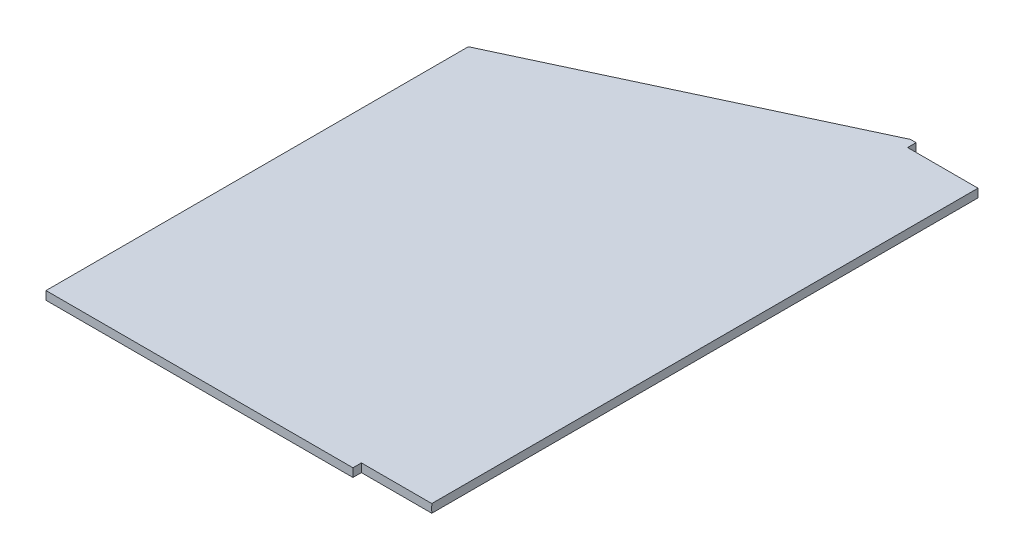
from build123d import *

# Parameters (mm, degrees)
BOSS_EXTRUDE1_DEPTH      = 1.5
BOSS_EXTRUDE1_DEPTH_BACK = 1.5
SKETCH2_R                = 51.2
CUT_EXTRUDE1_DEPTH       = 227.828679845
SKETCH3_R                = 76.2
CUT_EXTRUDE2_DEPTH       = 3
CUT_EXTRUDE3_START       = -3
SKETCH4_R                = 76.2
CUT_EXTRUDE3_DEPTH       = 3


with BuildPart() as part:
    # Sketch1 → Boss-Extrude1 (new, two sides: drawn at the far end of the back side and taken through both)
    with BuildSketch(Plane(origin=(0, 0, 0), x_dir=(1, 0, 0), z_dir=(0, 1, 0)).offset(-BOSS_EXTRUDE1_DEPTH_BACK)):
        Polygon((-107, 150), (-107, 0), (0, 0), (78.2, 0), (78.2, 200), (0, 200), align=None)
    extrude(amount=BOSS_EXTRUDE1_DEPTH + BOSS_EXTRUDE1_DEPTH_BACK)

    # Sketch2 → Cut-Extrude1 (cut, through all)
    with BuildSketch(Plane(origin=(0, 0, -200), x_dir=(-1, 0, 0), z_dir=(0, 0, -1))):
        with Locations((-78.2, 0)):
            Circle(SKETCH2_R)
    extrude(amount=-CUT_EXTRUDE1_DEPTH, mode=Mode.SUBTRACT)

    # Sketch3 → Cut-Extrude2 (cut)
    with BuildSketch(Plane(origin=(0, 0, -200), x_dir=(-1, 0, 0), z_dir=(0, 0, -1))):
        with Locations((-78.2, 0)):
            Circle(SKETCH3_R)
    extrude(amount=-CUT_EXTRUDE2_DEPTH, mode=Mode.SUBTRACT)

    # Sketch4 → Cut-Extrude3 (cut)
    with BuildSketch(Plane.XY.offset(CUT_EXTRUDE3_START)):
        with Locations((78.2, 0)):
            Circle(SKETCH4_R)
    extrude(amount=CUT_EXTRUDE3_DEPTH, mode=Mode.SUBTRACT)


solid = part.part
